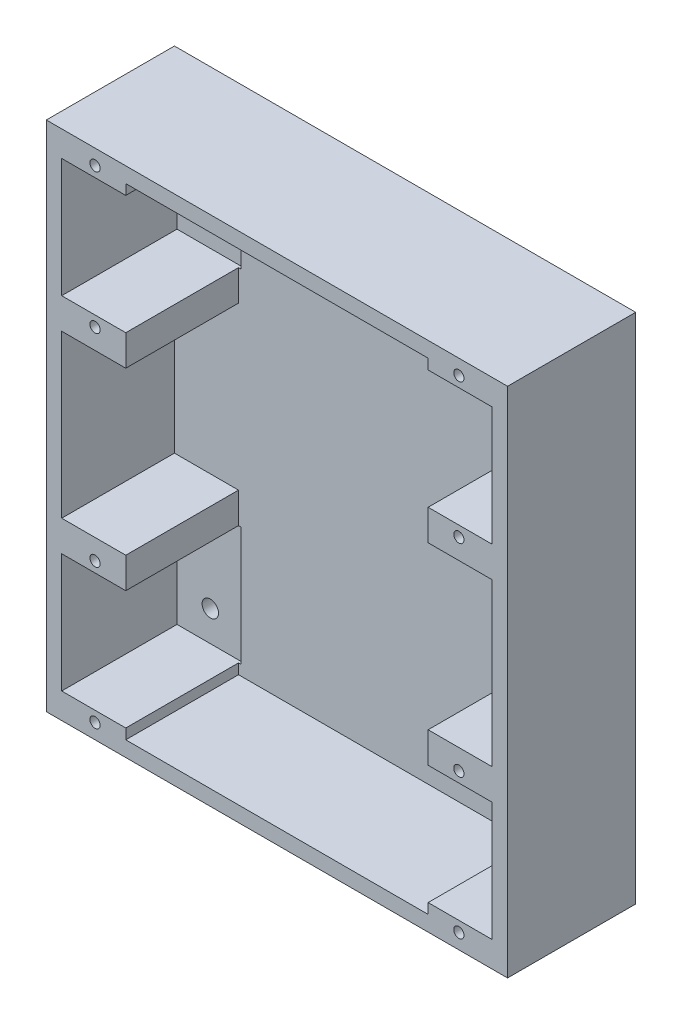
from build123d import *

# Parameters (mm, degrees)
ESBO_O1_W                = 90
ESBO_O1_H                = 100
ESBO_O1_R                = 1
ESBO_O1_W_2              = 13
ESBO_O1_H_2              = 23.2
RESSALTO_EXTRUS_O1_DEPTH = 25
CORTE_EXTRUS_O1_DEPTH    = 22
ESBO_O4_W                = 90
ESBO_O4_H                = 100
ESBO_O4_R                = 1.6
RESSALTO_EXTRUS_O2_DEPTH = 2.5


with BuildPart() as part:
    # Esboço1 → Ressalto-extrusão1 (new body)
    with BuildSketch(Plane.XY):
        Rectangle(ESBO_O1_W, ESBO_O1_H)
        with Locations((35.5, 19.75)):
            Circle(ESBO_O1_R, mode=Mode.SUBTRACT)
        with Locations((35.5, 47.05)):
            Circle(ESBO_O1_R, mode=Mode.SUBTRACT)
        with Locations(Location((35.5, -47.05, 0), (0, 0, 180))):
            Circle(ESBO_O1_R, mode=Mode.SUBTRACT)
        with Locations(Location((35.5, -19.75, 0), (0, 0, 180))):
            Circle(ESBO_O1_R, mode=Mode.SUBTRACT)
        with Locations((-35.5, -19.75)):
            Circle(ESBO_O1_R, mode=Mode.SUBTRACT)
        with Locations((-35.5, -47.05)):
            Circle(ESBO_O1_R, mode=Mode.SUBTRACT)
        with Locations(Location((-35.5, 47.05, 0), (0, 0, 180))):
            Circle(ESBO_O1_R, mode=Mode.SUBTRACT)
        with Locations(Location((-35.5, 19.75, 0), (0, 0, 180))):
            Circle(ESBO_O1_R, mode=Mode.SUBTRACT)
        with Locations((35.5, 33.4)):
            Rectangle(ESBO_O1_W_2, ESBO_O1_H_2, mode=Mode.SUBTRACT)
        with Locations((35.5, -33.4)):
            Rectangle(ESBO_O1_W_2, ESBO_O1_H_2, mode=Mode.SUBTRACT)
        with Locations((-35.5, -33.4)):
            Rectangle(ESBO_O1_W_2, ESBO_O1_H_2, mode=Mode.SUBTRACT)
        with Locations((-35.5, 33.4)):
            Rectangle(ESBO_O1_W_2, ESBO_O1_H_2, mode=Mode.SUBTRACT)
    extrude(amount=RESSALTO_EXTRUS_O1_DEPTH)

    # Esboço3 → Corte-extrusão1 (cut)
    with BuildSketch(Plane.XY.offset(25)):
        Polygon((-29.5, 47), (29.5, 47), (29.5, 15.8), (42, 15.8), (42, -15.8), (29.5, -15.8), (29.5, -47), (-29.5, -47), (-29.5, -15.8), (-42, -15.8), (-42, 15.8), (-29.5, 15.8), align=None)
    extrude(amount=-CORTE_EXTRUS_O1_DEPTH, mode=Mode.SUBTRACT)

    # Esboço4 → Ressalto-extrusão2 (add)
    with BuildSketch(Plane(origin=(0, 0, 0), x_dir=(-1, 0, 0), z_dir=(0, 0, -1))):
        Rectangle(ESBO_O4_W, ESBO_O4_H)
        with Locations((-35.5, -39.05)):
            Circle(ESBO_O4_R, mode=Mode.SUBTRACT)
        with Locations(Location((-35.5, 39.05, 0), (0, 0, 180))):
            Circle(ESBO_O4_R, mode=Mode.SUBTRACT)
        with Locations((35.5, 39.05)):
            Circle(ESBO_O4_R, mode=Mode.SUBTRACT)
        with Locations(Location((35.5, -39.05, 0), (0, 0, 180))):
            Circle(ESBO_O4_R, mode=Mode.SUBTRACT)
    extrude(amount=-RESSALTO_EXTRUS_O2_DEPTH)


solid = part.part
